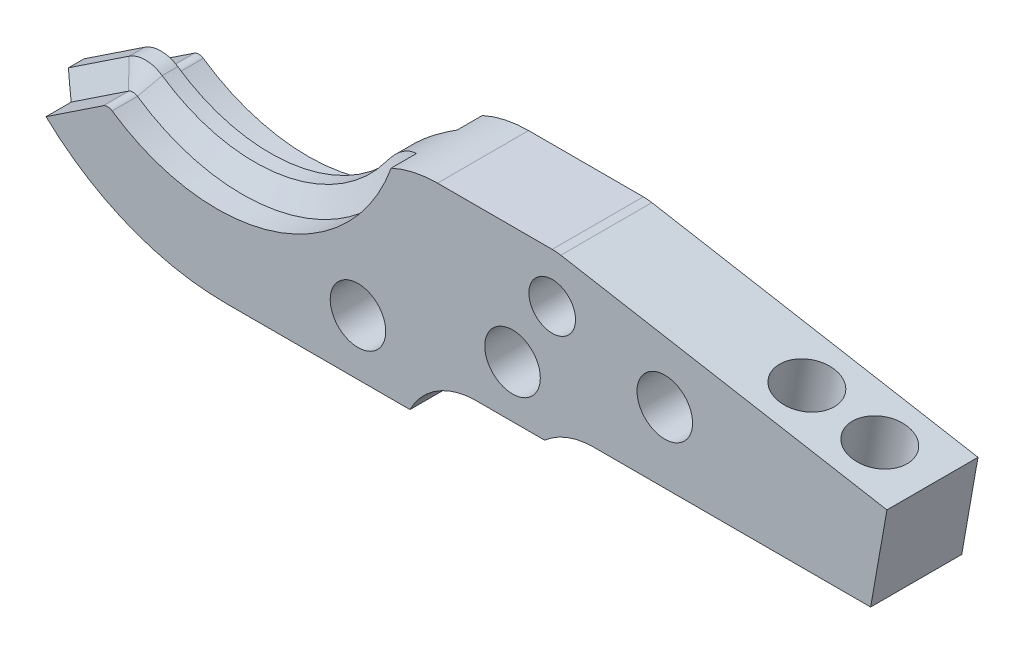
from build123d import *

# Parameters (mm, degrees)
EXTRUDE1_DEPTH                   = 15.621
SKETCH5_W                        = 270.806573858
SKETCH5_H                        = 166.102939791
EXTRUDE2_DEPTH                   = 160.670835286
SKETCH6_R                        = 4
EXTRUDE3_DEPTH                   = 160.670835296
EXTRUDE4_DEPTH                   = 160.670835296
F_3_8_0_375_DIAMETER_HOLE1_D     = 9.525
F_3_8_0_375_DIAMETER_HOLE1_DEPTH = 25.4
F_3_8_0_375_DIAMETER_HOLE1_TIP   = 1.733408241
F_3_8_0_375_DIAMETER_HOLE2_D     = 9.525
F_3_8_0_375_DIAMETER_HOLE2_DEPTH = 9.7639886
F_3_8_0_375_DIAMETER_HOLE2_TIP   = 1.733408241
EXTRUDE7_DEPTH                   = 125.388654342
EXTRUDE7_DEPTH_BACK              = 125.388654342


with BuildPart() as part:
    # Sketch1 → Extrude1 (new body)
    with BuildSketch(Plane.XY):
        with BuildLine():
            Line((-18.523440753, -21.052635779), (-31.956486184, -29.996682998))
            ThreePointArc((-31.956486184, -29.996682998), (-16.785704199, -41.078283404), (1.5875, -45))
            Line((1.5875, -45), (33.100991233, -45))
            ThreePointArc((33.100991233, -45), (37.78291668, -39.890744707), (44.45, -38))
            Line((44.45, -38), (152.4, -38))
            Line((152.4, -38), (152.4, -21.7))
            Line((152.4, -21.7), (139.7, -21.7))
            Line((139.7, -21.7), (139.7, -9))
            Line((139.7, -9), (26.558074677, -9))
            ThreePointArc((26.558074677, -9), (7.242606084, -27.090145582), (-18.523440753, -21.052635779))
        make_face()
    extrude(amount=EXTRUDE1_DEPTH)

    # Cut-Sweep1: sweep along a path in Sketch4
    with BuildLine(Plane.XY.offset(15.621)) as cut_sweep1_path:
        Line((-31.956486184, -29.996682998), (-26.708036397, -26.502137926))
        Line((-26.708036397, -26.502137926), (-21.563139896, -23.076541141))
        ThreePointArc((-21.563139896, -23.076541141), (-18.711510192, -22.22512912), (-15.872310869, -23.117116564))
        ThreePointArc((-15.872310869, -23.117116564), (8.852662428, -26.607549652), (26.558074677, -9))
    # Sketch3 → Cut-Sweep1 (sweep, cut)
    with BuildSketch(Plane(origin=(26.558074677, -9, 15.621), x_dir=(0.9470955536490446, -0.3209517288599796, 0), z_dir=(-0.3209517288599796, -0.9470955536490446, 0))):
        Polygon((-25.4, 0), (3.7084, 0), (3.7084, -4.335954262), (0, -6.477), (0, -9.144), (3.7084, -11.285045738), (3.7084, -15.621), (-25.4, -15.621), (-25.4, -7.8105), align=None)
    sweep(path=cut_sweep1_path.line, mode=Mode.SUBTRACT)

    # Sketch5 → Extrude2 (cut, through all)
    with BuildSketch(Plane.XY.offset(15.621)):
        with Locations((52.123498329, -22.277908904)):
            Rectangle(SKETCH5_W, SKETCH5_H)
        with BuildLine():
            Line((38.333012193, 16.803768596), (31.532220939, 12.275636952))
            ThreePointArc((31.532220939, 12.275636952), (27.554347044, 11.558888171), (24.312391752, 13.972792773))
            ThreePointArc((24.312391752, 13.972792773), (-27.994081927, 1.631780505), (22.524298891, -16.702912621))
            ThreePointArc((22.524298891, -16.702912621), (29.260489218, -11.034352575), (37.826132376, -9))
            Line((37.826132376, -9), (139.7, -9))
            Line((139.7, -9), (139.7, -21.7))
            Line((139.7, -21.7), (152.4, -21.7))
            Line((152.4, -21.7), (152.4, -45))
            Line((152.4, -45), (1.5875, -45))
            ThreePointArc((1.5875, -45), (-37.731008972, 21.887321724), (39.835360247, 23.708673234))
            ThreePointArc((39.835360247, 23.708673234), (40.481466367, 19.95220497), (38.333012193, 16.803768596))
        make_face(mode=Mode.SUBTRACT)
    extrude(amount=-EXTRUDE2_DEPTH, mode=Mode.SUBTRACT)

    # Sketch6 → Extrude3 (cut, through all)
    with BuildSketch(Plane(origin=(0, 0, 0), x_dir=(-1, 0, 0), z_dir=(0, 0, -1))):
        with Locations((-57.5, -17.4625)):
            Circle(SKETCH6_R)
    extrude(amount=-EXTRUDE3_DEPTH, mode=Mode.SUBTRACT)

    # Sketch7 → Extrude4 (cut, through all)
    with BuildSketch(Plane(origin=(0, 0, 0), x_dir=(-1, 0, 0), z_dir=(0, 0, -1))):
        with BuildLine():
            Line((-58.969497704, -9.12856439), (-114.906578075, -18.991780882))
            Line((-114.906578075, -18.991780882), (-110.320627324, -45))
            Line((-110.320627324, -45), (-152.4, -45))
            Line((-152.4, -45), (-152.4, -9))
            Line((-152.4, -9), (-57.5, -9))
            ThreePointArc((-57.5, -9), (-58.237555473, -9.032202367), (-58.969497704, -9.12856439))
        make_face()
    extrude(amount=-EXTRUDE4_DEPTH, mode=Mode.SUBTRACT)

    # 3/8 (0.375) Diameter Hole1
    with Locations(Plane(origin=(0, 0, 0), x_dir=(-1, 0, 0), z_dir=(0, 0, -1))):
        with Locations((-24.181578009, -35.475), (-50.694078075, -29.125), (-76.806578075, -22.775)):
            Hole(F_3_8_0_375_DIAMETER_HOLE1_D / 2, depth=F_3_8_0_375_DIAMETER_HOLE1_DEPTH)
            with Locations((0, 0, -(F_3_8_0_375_DIAMETER_HOLE1_DEPTH + F_3_8_0_375_DIAMETER_HOLE1_TIP / 2))):  # 140° drill point
                Cone(0, F_3_8_0_375_DIAMETER_HOLE1_D / 2, F_3_8_0_375_DIAMETER_HOLE1_TIP, mode=Mode.SUBTRACT)

    # 3/8 (0.375) Diameter Hole2
    with Locations(Plane(origin=(0.217071479, 1.231073535, 0), x_dir=(-0.9848077530122092, 0.17364817766692367, 0), z_dir=(0.17364817766692367, 0.9848077530122092, 0))):
        with Locations((-94.583777101, 7.8105), (-107.283777101, 7.8105)):
            Hole(F_3_8_0_375_DIAMETER_HOLE2_D / 2, depth=F_3_8_0_375_DIAMETER_HOLE2_DEPTH)
            with Locations((0, 0, -(F_3_8_0_375_DIAMETER_HOLE2_DEPTH + F_3_8_0_375_DIAMETER_HOLE2_TIP / 2))):  # 140° drill point
                Cone(0, F_3_8_0_375_DIAMETER_HOLE2_D / 2, F_3_8_0_375_DIAMETER_HOLE2_TIP, mode=Mode.SUBTRACT)

    # Sketch13 → Extrude7 (cut, two sides: drawn at the far end of the back side and taken through both)
    with BuildSketch(Plane.XY.offset(15.621).offset(-EXTRUDE7_DEPTH_BACK)):
        with BuildLine():
            Line((-170.850798283, -238.240416596), (56.200492318, -38))
            ThreePointArc((56.200492318, -38), (60.110624671, -35.645237797), (64.600752731, -34.825))
            Line((64.600752731, -34.825), (112.114754353, -34.825))
            Line((112.114754353, -34.825), (414.849808488, -34.825))
            Line((414.849808488, -34.825), (613.492170854, -606.782396913))
            Line((613.492170854, -606.782396913), (27.791564083, -810.197813509))
            Line((27.791564083, -810.197813509), (-170.850798283, -238.240416596))
        make_face()
    extrude(amount=EXTRUDE7_DEPTH + EXTRUDE7_DEPTH_BACK, mode=Mode.SUBTRACT)


solid = part.part
